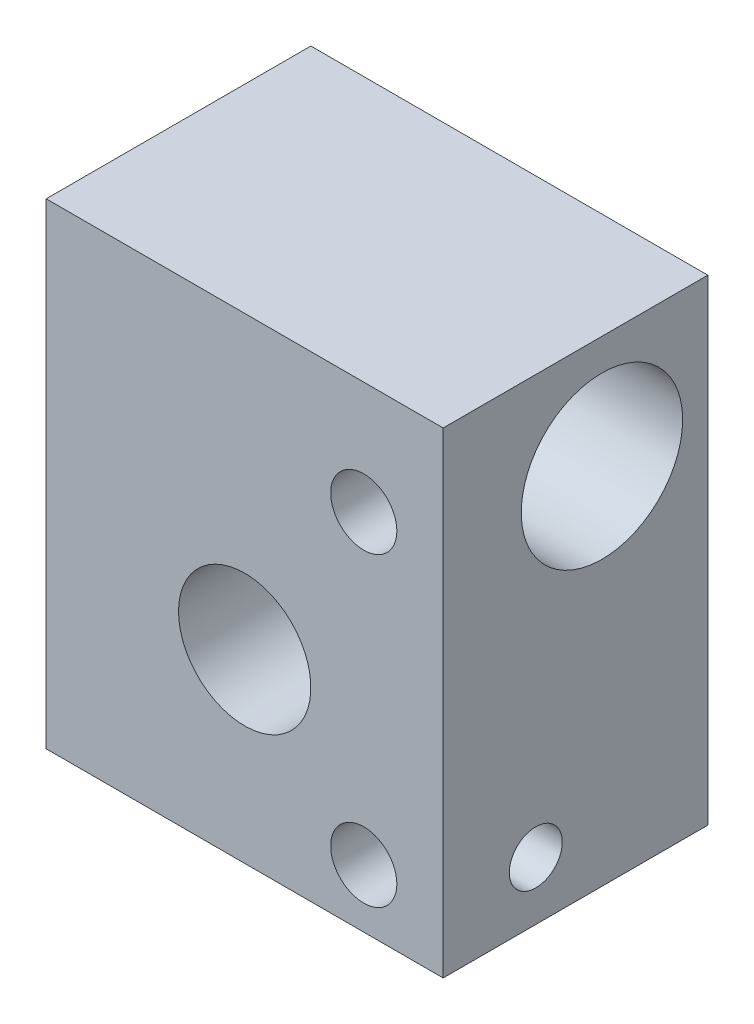
from build123d import *

# Parameters (mm, degrees)
SKETCH1_W                           = 15
SKETCH1_H                           = 18
BOSS_EXTRUDE1_DEPTH                 = 10
SKETCH2_R                           = 2.5
CUT_EXTRUDE1_DEPTH                  = 16.402921801
SKETCH3_R                           = 3.05
CUT_EXTRUDE2_DEPTH                  = 21.14944168
TALADRO_ROSCADO_M31_D               = 2.5
TALADRO_ROSCADO_M31_DEPTH           = 4
TALADRO_ROSCADO_M31_TIP             = 0.751075774
DI_METRO_DE_TALADRO_2_8_2_8_1_D     = 2
DI_METRO_DE_TALADRO_2_8_2_8_1_DEPTH = 12
DI_METRO_DE_TALADRO_2_8_2_8_1_TIP   = 0.600860619


with BuildPart() as part:
    # Sketch1 → Boss-Extrude1 (new body)
    with BuildSketch(Plane.XY):
        Rectangle(SKETCH1_W, SKETCH1_H)
    extrude(amount=BOSS_EXTRUDE1_DEPTH)

    # Sketch2 → Cut-Extrude1 (cut, through all)
    with BuildSketch(Plane(origin=(0, 0, 0), x_dir=(-1, 0, 0), z_dir=(0, 0, -1))):
        with Locations((0, -2)):
            Circle(SKETCH2_R)
    extrude(amount=-CUT_EXTRUDE1_DEPTH, mode=Mode.SUBTRACT)

    # Sketch3 → Cut-Extrude2 (cut, through all)
    with BuildSketch(Plane(origin=(7.5, 0, 0), x_dir=(0, 0, -1), z_dir=(1, 0, 0))):
        with Locations((-4, 4.75)):
            Circle(SKETCH3_R)
    extrude(amount=-CUT_EXTRUDE2_DEPTH, mode=Mode.SUBTRACT)

    # Taladro roscado M31
    with Locations(Plane(origin=(-2.648652683, -2.97524228, 10), x_dir=(1, 0, 0), z_dir=(0, 0, 1))):
        with Locations((7.148652683, 7.72524228), (7.148652683, -3.82475772)):
            Hole(TALADRO_ROSCADO_M31_D / 2, depth=TALADRO_ROSCADO_M31_DEPTH)
            with Locations((0, 0, -(TALADRO_ROSCADO_M31_DEPTH + TALADRO_ROSCADO_M31_TIP / 2))):  # 118° drill point
                Cone(0, TALADRO_ROSCADO_M31_D / 2, TALADRO_ROSCADO_M31_TIP, mode=Mode.SUBTRACT)

    # Diámetro de taladro Ø2.8 (2.8)1
    with Locations(Plane(origin=(7.5, -6.8, 6.5), x_dir=(0, 0, 1), z_dir=(1, 0, 0))):
        with Locations((0, 0)):
            Hole(DI_METRO_DE_TALADRO_2_8_2_8_1_D / 2, depth=DI_METRO_DE_TALADRO_2_8_2_8_1_DEPTH)
            with Locations((0, 0, -(DI_METRO_DE_TALADRO_2_8_2_8_1_DEPTH + DI_METRO_DE_TALADRO_2_8_2_8_1_TIP / 2))):  # 118° drill point
                Cone(0, DI_METRO_DE_TALADRO_2_8_2_8_1_D / 2, DI_METRO_DE_TALADRO_2_8_2_8_1_TIP, mode=Mode.SUBTRACT)


solid = part.part
